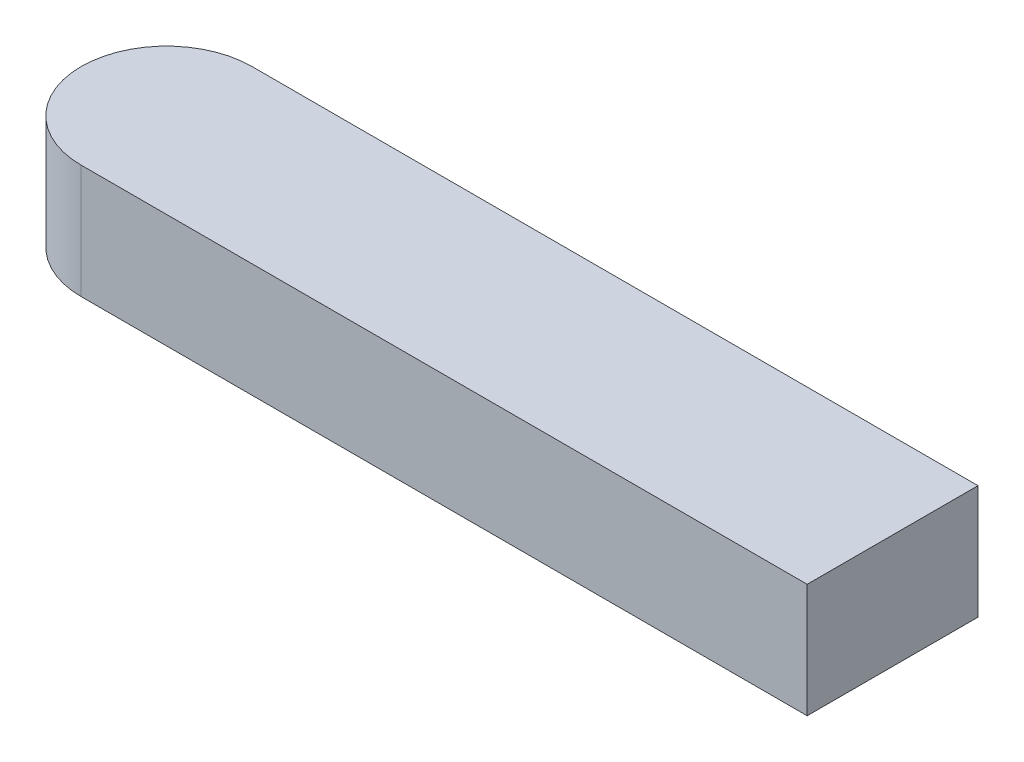
from build123d import *

# Parameters (mm, degrees)
BOSS_EXTRUDE1_DEPTH = 4


with BuildPart() as part:
    # Sketch1 → Boss-Extrude1 (new, symmetric)
    with BuildSketch(Plane(origin=(0, 0, 0), x_dir=(1, 0, 0), z_dir=(0, 1, 0))):
        with BuildLine():
            Line((-14.27027027, 6), (36.72972973, 6))
            Line((36.72972973, 6), (36.72972973, -6))
            Line((36.72972973, -6), (-14.27027027, -6))
            ThreePointArc((-14.27027027, -6), (-20.27027027, 0), (-14.27027027, 6))
        make_face()
    extrude(amount=BOSS_EXTRUDE1_DEPTH, both=True)


solid = part.part
